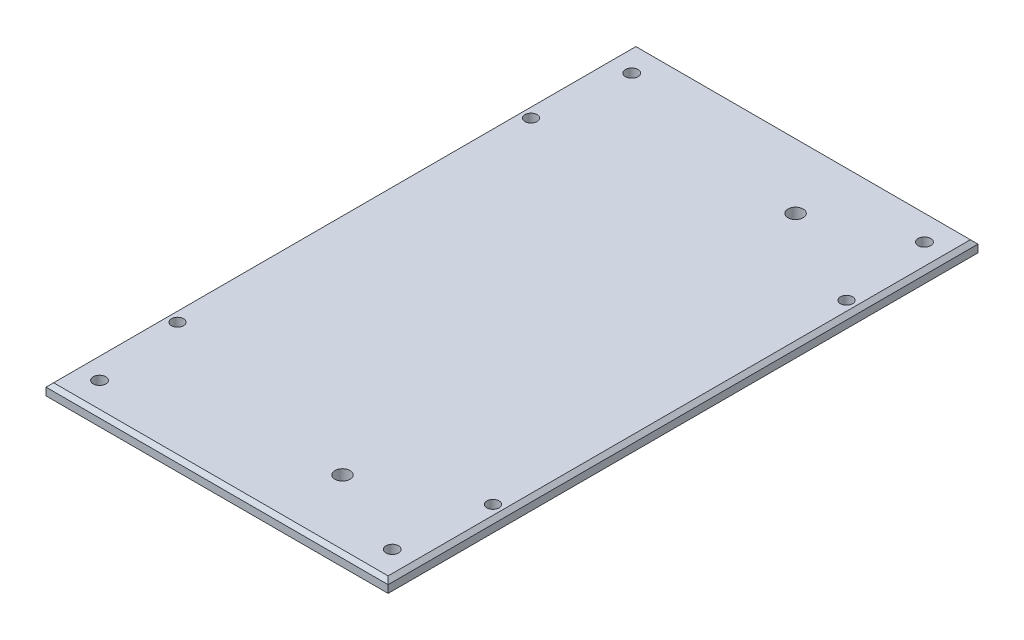
from build123d import *

# Parameters (mm, degrees)
SKETCH1_W           = 90
SKETCH1_H           = 155.172413794
SKETCH1_R           = 1.655172414
BOSS_EXTRUDE1_DEPTH = 3
CUT_EXTRUDE1_DEPTH  = 90.741960646
CHAMFER1_SIZE       = 1
CHAMFER2_SIZE       = 1
SKETCH6_R           = 2
CUT_EXTRUDE2_DEPTH  = 3


with BuildPart() as part:
    # Sketch1 → Boss-Extrude1 (new body)
    with BuildSketch(Plane(origin=(0, 0, 0), x_dir=(1, 0, 0), z_dir=(0, 1, 0))):
        Rectangle(SKETCH1_W, SKETCH1_H)
        with Locations(Location((38.5, -70, 0), (0, 0, 270))):
            Circle(SKETCH1_R, mode=Mode.SUBTRACT)
        with Locations(Location((-38.5, -70, 0), (0, 0, 270))):
            Circle(SKETCH1_R, mode=Mode.SUBTRACT)
        with Locations(Location((38.5, 70, 0), (0, 0, 270))):
            Circle(SKETCH1_R, mode=Mode.SUBTRACT)
        with Locations(Location((-38.5, 70, 0), (0, 0, 270))):
            Circle(SKETCH1_R, mode=Mode.SUBTRACT)
    extrude(amount=BOSS_EXTRUDE1_DEPTH)

    # Sketch2 → Cut-Extrude1 (cut, through all)
    with BuildSketch(Plane(origin=(0, 3, 0), x_dir=(1, 0, 0), z_dir=(0, 1, 0))):
        with BuildLine():
            ThreePointArc((-39.9, 46.5), (-42.63137085, 47.63137085), (-41.5, 44.9))
            Line((-41.5, 44.9), (-41.5, 46.5))
            Line((-41.5, 46.5), (-39.9, 46.5))
        make_face()
        with BuildLine():
            Line((-41.5, 46.5), (-41.5, 44.9))
            ThreePointArc((-41.5, 44.9), (-40.36862915, 45.36862915), (-39.9, 46.5))
            Line((-39.9, 46.5), (-41.5, 46.5))
        make_face()
        with BuildLine():
            ThreePointArc((39.9, 46.5), (40.36862915, 45.36862915), (41.5, 44.9))
            Line((41.5, 44.9), (41.5, 46.5))
            Line((41.5, 46.5), (39.9, 46.5))
        make_face()
        with BuildLine():
            Line((41.5, 46.5), (41.5, 44.9))
            ThreePointArc((41.5, 44.9), (42.63137085, 45.36862915), (43.1, 46.5))
            ThreePointArc((43.1, 46.5), (41.5, 48.1), (39.9, 46.5))
            Line((39.9, 46.5), (41.5, 46.5))
        make_face()
        with BuildLine():
            ThreePointArc((41.5, -44.9), (40.36862915, -45.36862915), (39.9, -46.5))
            Line((39.9, -46.5), (41.5, -46.5))
            Line((41.5, -46.5), (41.5, -44.9))
        make_face()
        with BuildLine():
            Line((41.5, -46.5), (39.9, -46.5))
            ThreePointArc((39.9, -46.5), (41.5, -48.1), (43.1, -46.5))
            ThreePointArc((43.1, -46.5), (42.63137085, -45.36862915), (41.5, -44.9))
            Line((41.5, -44.9), (41.5, -46.5))
        make_face()
        with BuildLine():
            Line((-41.5, -44.9), (-41.5, -46.5))
            Line((-41.5, -46.5), (-39.9, -46.5))
            ThreePointArc((-39.9, -46.5), (-40.36862915, -45.36862915), (-41.5, -44.9))
        make_face()
        with BuildLine():
            Line((-39.9, -46.5), (-41.5, -46.5))
            Line((-41.5, -46.5), (-41.5, -44.9))
            ThreePointArc((-41.5, -44.9), (-42.63137085, -47.63137085), (-39.9, -46.5))
        make_face()
    extrude(amount=-CUT_EXTRUDE1_DEPTH, mode=Mode.SUBTRACT)

    # Chamfer1
    chamfer1_edges = [part.edges().sort_by_distance(p)[0] for p in [
        (0, 3, 77.586206897),
        (0, 3, -77.586206897),
    ]]
    chamfer(chamfer1_edges, length=CHAMFER1_SIZE)

    # Chamfer2
    chamfer2_edges = [part.edges().sort_by_distance(p)[0] for p in [
        (45, 3, 0),
        (-45, 3, 0),
    ]]
    chamfer(chamfer2_edges, length=CHAMFER2_SIZE)

    # Sketch6 → Cut-Extrude2 (cut)
    with BuildSketch(Plane(origin=(0, 3, 0), x_dir=(1, 0, 0), z_dir=(0, 1, 0))):
        with Locations(Location((15, -59.586206897, 0), (0, 0, 270))):
            Circle(SKETCH6_R)
        with Locations(Location((15, 59.586206897, 0), (0, 0, 270))):
            Circle(SKETCH6_R)
    extrude(amount=-CUT_EXTRUDE2_DEPTH, mode=Mode.SUBTRACT)


solid = part.part
